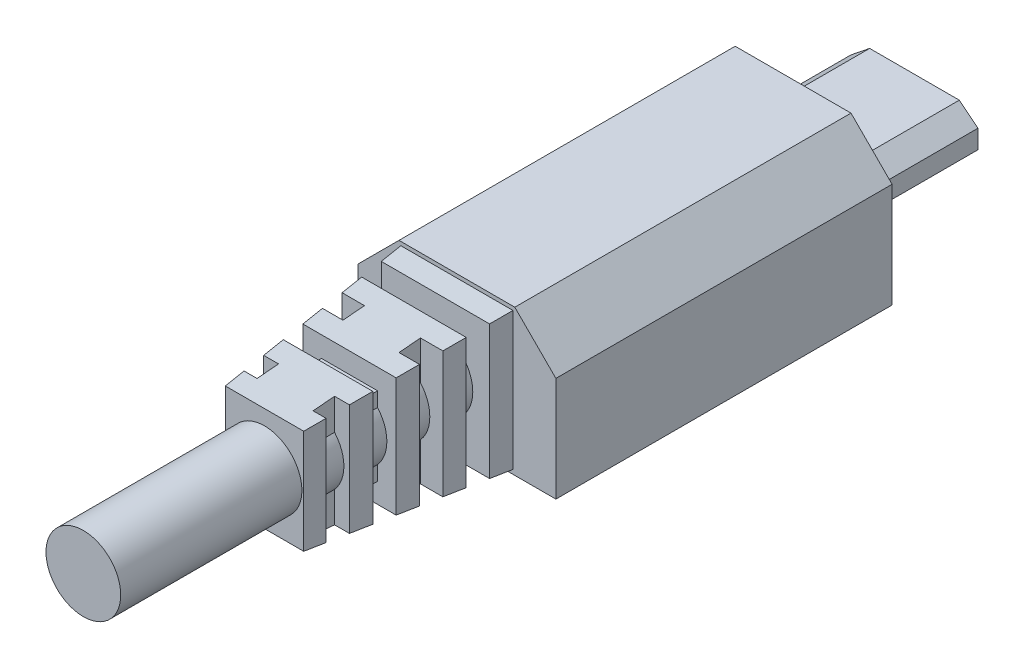
from build123d import *

# Parameters (mm, degrees)
BOSS_EXTRUDE1_DEPTH = 6.5
SKETCH2_W           = 3.7
SKETCH2_H           = 0.65
BOSS_EXTRUDE2_DEPTH = 18
SKETCH5_W           = 6
SKETCH5_H           = 7.371976581
BOSS_EXTRUDE4_DEPTH = 10.3
BOSS_EXTRUDE4_TAPER = 5
SKETCH7_W           = 2.169554373
SKETCH7_H           = 1.15
CUT_EXTRUDE1_DEPTH  = 10.3
SKETCH9_W           = 1.15
SKETCH9_H           = 1.6
CUT_EXTRUDE2_DEPTH  = 10.3
SKETCH3_R           = 2
BOSS_EXTRUDE3_DEPTH = 20


with BuildPart() as part:
    # Sketch1 → Boss-Extrude1 (new body)
    with BuildSketch(Plane.XY):
        Polygon((1, 1.8), (0, 1), (0, 0), (3.4, 0), (3.4, 0.2), (1.55, 0.2), (1.55, 0.85), (3.4, 0.85), (3.4, 1.8), align=None)
        Polygon((5.8, 1.8), (3.4, 1.8), (3.4, 0.85), (5.25, 0.85), (5.25, 0.2), (3.4, 0.2), (3.4, 0), (6.8, 0), (6.8, 1), align=None)
    extrude(amount=BOSS_EXTRUDE1_DEPTH)

    # Sketch2 → Boss-Extrude2 (add)
    # profile 1 of 3: a face of its own
    with BuildSketch(Plane.XY.offset(6.5)):
        Polygon((6.5, 4.8), (0.3, 4.8), (-1.9, 2.6), (-1.9, -3), (8.7, -3), (8.7, 2.6), align=None)
        Polygon((5.8, 1.8), (6.8, 1), (6.8, 0), (0, 0), (0, 1), (1, 1.8), align=None, mode=Mode.SUBTRACT)
    # profile 2 of 3: a face of its own
    with BuildSketch(Plane.XY.offset(6.5)):
        Polygon((6.8, 0), (6.8, 1), (5.8, 1.8), (1, 1.8), (0, 1), (0, 0), align=None)
        with Locations((3.4, 0.525)):
            Rectangle(SKETCH2_W, SKETCH2_H, mode=Mode.SUBTRACT)
    # profile 3 of 3: a face of its own
    with BuildSketch(Plane.XY.offset(6.5)):
        with Locations((3.4, 0.525)):
            Rectangle(SKETCH2_W, SKETCH2_H)
    extrude(amount=BOSS_EXTRUDE2_DEPTH)

    # Sketch5 → Boss-Extrude4 (add)
    with BuildSketch(Plane.XY.offset(24.5)):
        with Locations((3.4, 0.91401171)):
            Rectangle(SKETCH5_W, SKETCH5_H)
    extrude(amount=BOSS_EXTRUDE4_DEPTH, taper=BOSS_EXTRUDE4_TAPER)

    # Sketch7 → Cut-Extrude1 (cut)
    with BuildSketch(Plane(origin=(0, 4.8, 0), x_dir=(1, 0, 0), z_dir=(0, 1, 0))):
        Polygon((1.9, -25.65), (0.3, -25.65), (-0.269554373, -25.65), (-0.269554373, -26.8), (1.9, -26.8), align=None)
        with Locations((0.815222814, -28.525)):
            Rectangle(SKETCH7_W, SKETCH7_H)
        with Locations((0.815222814, -30.825)):
            Rectangle(SKETCH7_W, SKETCH7_H)
        with Locations((0.815222814, -33.125)):
            Rectangle(SKETCH7_W, SKETCH7_H)
        with Locations((5.984777187, -26.225)):
            Rectangle(SKETCH7_W, SKETCH7_H)
        with Locations((5.984777187, -28.525)):
            Rectangle(SKETCH7_W, SKETCH7_H)
        with Locations((5.984777187, -30.825)):
            Rectangle(SKETCH7_W, SKETCH7_H)
        with Locations((5.984777187, -33.125)):
            Rectangle(SKETCH7_W, SKETCH7_H)
    extrude(amount=-CUT_EXTRUDE1_DEPTH, mode=Mode.SUBTRACT)

    # Sketch9 → Cut-Extrude2 (cut)
    with BuildSketch(Plane(origin=(8.7, 0, 0), x_dir=(0, 0, -1), z_dir=(1, 0, 0))):
        with Locations((-26.225, 3.8)):
            Rectangle(SKETCH9_W, SKETCH9_H)
        with Locations((-30.825, 3.8)):
            Rectangle(SKETCH9_W, SKETCH9_H)
        with Locations((-26.225, -2)):
            Rectangle(SKETCH9_W, SKETCH9_H)
        with Locations((-30.825, -2)):
            Rectangle(SKETCH9_W, SKETCH9_H)
    extrude(amount=-CUT_EXTRUDE2_DEPTH, mode=Mode.SUBTRACT)

    # Sketch3 → Boss-Extrude3 (add)
    with BuildSketch(Plane.XY.offset(24.5)):
        with Locations(Location((3.4, 0.9, 0), (0, 0, 180))):
            Circle(SKETCH3_R)
    extrude(amount=BOSS_EXTRUDE3_DEPTH)


solid = part.part
